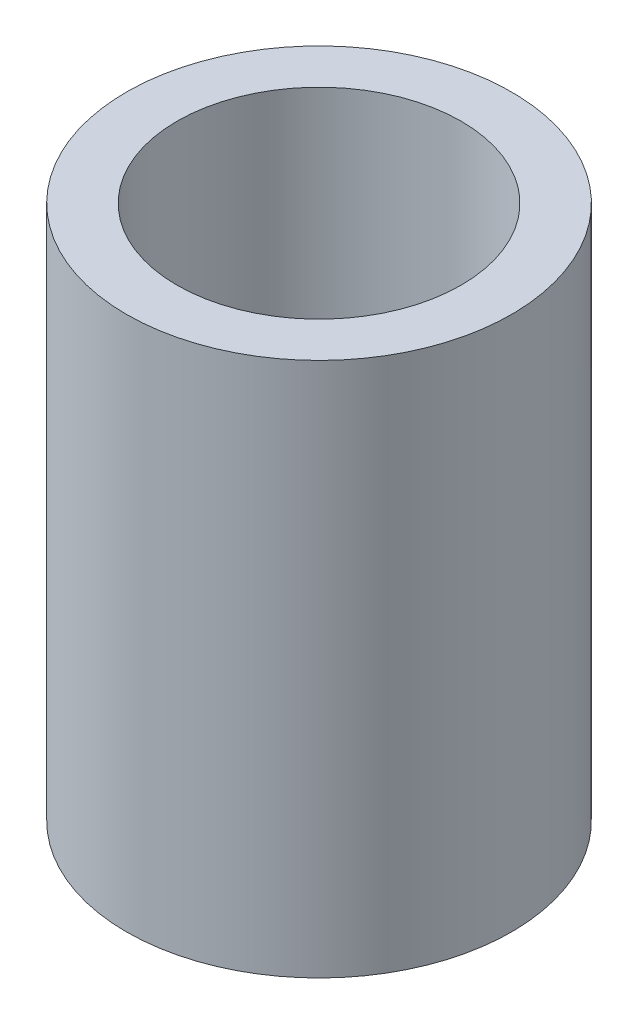
from build123d import *

# Parameters (mm, degrees)
SKETCH1_R           = 4.5734375
SKETCH1_R_2         = 3.3734375
BOSS_EXTRUDE1_DEPTH = 3.175
SKETCH2_R           = 4.5734375
SKETCH2_R_2         = 3.3734375
BOSS_EXTRUDE2_DEPTH = 9.525


with BuildPart() as part:
    # Sketch1 → Boss-Extrude1 (new body)
    with BuildSketch(Plane(origin=(0, 0, 0), x_dir=(1, 0, 0), z_dir=(0, 1, 0))):
        with Locations(Location((0, 0, 0), (0, 0, 270))):
            Circle(SKETCH1_R)
        with Locations(Location((0, 0, 0), (0, 0, 270))):
            Circle(SKETCH1_R_2, mode=Mode.SUBTRACT)
    extrude(amount=BOSS_EXTRUDE1_DEPTH)

    # Sketch2 → Boss-Extrude2 (add)
    with BuildSketch(Plane(origin=(0, 3.175, 0), x_dir=(1, 0, 0), z_dir=(0, 1, 0))):
        with Locations(Location((0, 0, 0), (0, 0, 270))):
            Circle(SKETCH2_R)
        with Locations(Location((0, 0, 0), (0, 0, 270))):
            Circle(SKETCH2_R_2, mode=Mode.SUBTRACT)
    extrude(amount=BOSS_EXTRUDE2_DEPTH)


solid = part.part
